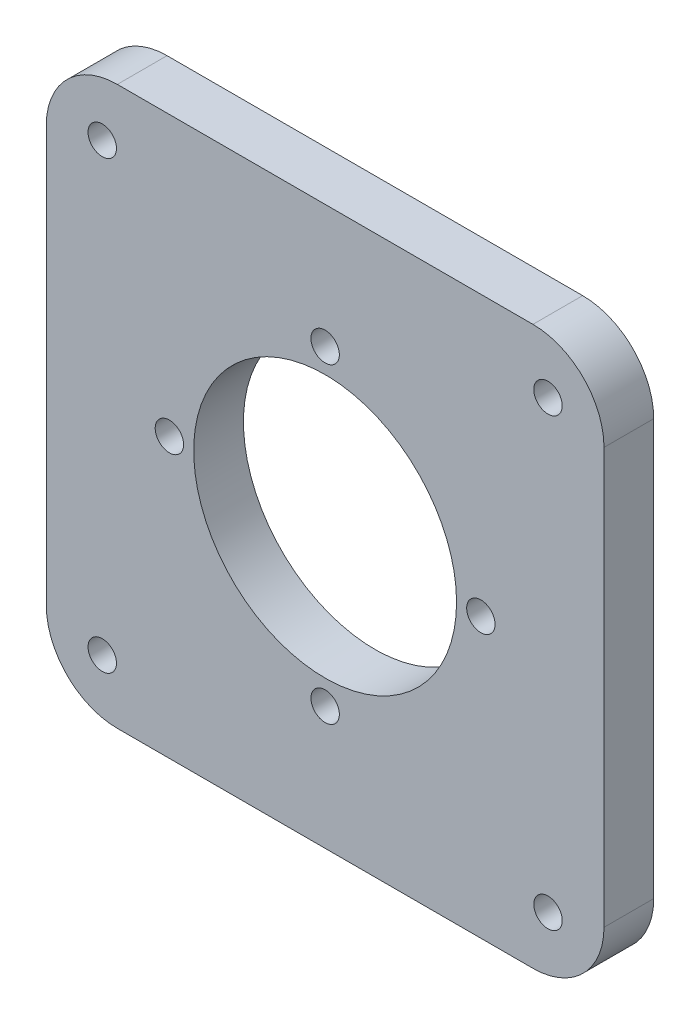
from build123d import *

# Parameters (mm, degrees)
SKETCH1_W           = 78.5
SKETCH1_H           = 78.5
BOSS_EXTRUDE1_DEPTH = 3.5
FILLET1_R           = 10
SKETCH2_R           = 2
CUT_EXTRUDE1_DEPTH  = 56.947520052
SKETCH3_R           = 18.5
CUT_EXTRUDE2_DEPTH  = 56.947520052
SKETCH4_R           = 2
CUT_EXTRUDE3_DEPTH  = 56.947520052


with BuildPart() as part:
    # Sketch1 → Boss-Extrude1 (new, symmetric)
    with BuildSketch(Plane.XY):
        Rectangle(SKETCH1_W, SKETCH1_H)
    extrude(amount=BOSS_EXTRUDE1_DEPTH, both=True)

    # Fillet1
    fillet1_edges = [part.edges().sort_by_distance(p)[0] for p in [
        (39.25, -39.25, 0),
        (-39.25, -39.25, 0),
        (-39.25, 39.25, 0),
        (39.25, 39.25, 0),
    ]]
    fillet(fillet1_edges, radius=FILLET1_R)

    # Sketch2 → Cut-Extrude1 (cut, through all)
    with BuildSketch(Plane.XY.offset(3.5)):
        with Locations((-31.371320344, 31.371320344)):
            Circle(SKETCH2_R)
        with Locations(Location((-31.371320344, -31.371320344, 0), (0, 0, 180))):
            Circle(SKETCH2_R)
        with Locations(Location((31.371320344, 31.371320344, 0), (0, 0, 180))):
            Circle(SKETCH2_R)
        with Locations((31.371320344, -31.371320344)):
            Circle(SKETCH2_R)
    extrude(amount=-CUT_EXTRUDE1_DEPTH, mode=Mode.SUBTRACT)

    # Sketch3 → Cut-Extrude2 (cut, through all)
    with BuildSketch(Plane.XY.offset(3.5)):
        Circle(SKETCH3_R)
    extrude(amount=-CUT_EXTRUDE2_DEPTH, mode=Mode.SUBTRACT)

    # Sketch4 → Cut-Extrude3 (cut, through all)
    with BuildSketch(Plane.XY.offset(3.5)):
        with Locations((0, 21.920310217)):
            Circle(SKETCH4_R)
        with Locations((-21.920310217, 0)):
            Circle(SKETCH4_R)
        with Locations((0, -21.920310217)):
            Circle(SKETCH4_R)
        with Locations((21.920310217, 0)):
            Circle(SKETCH4_R)
    extrude(amount=-CUT_EXTRUDE3_DEPTH, mode=Mode.SUBTRACT)


solid = part.part
